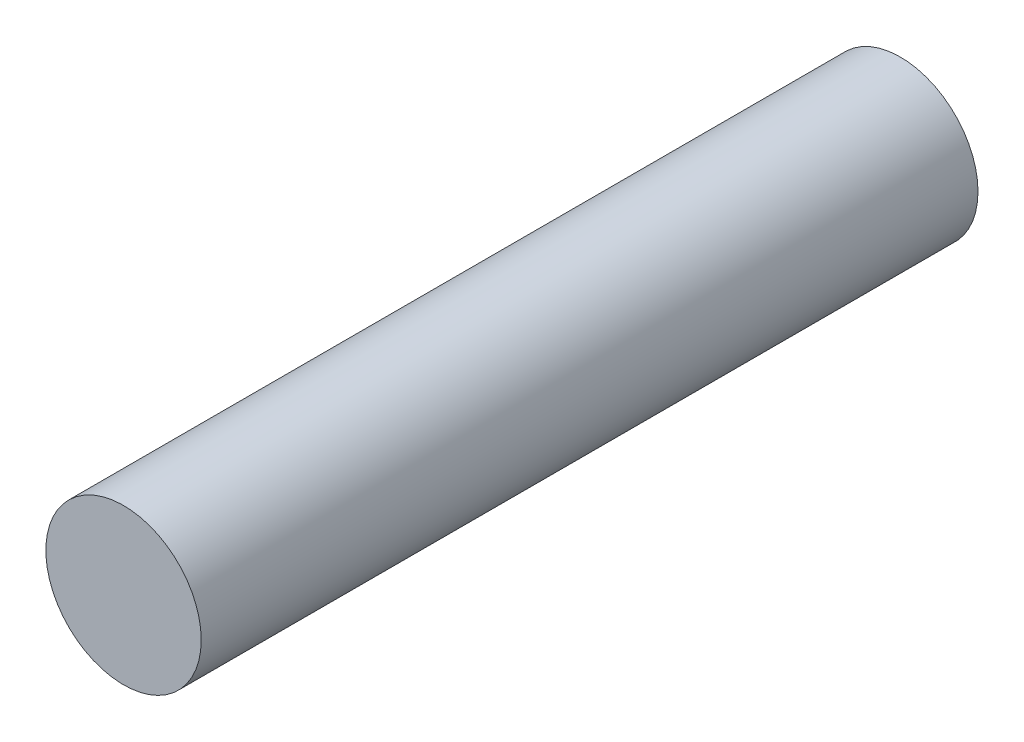
from build123d import *

# Parameters (mm, degrees)
SKETCH1_R           = 1
BOSS_EXTRUDE1_DEPTH = 10


with BuildPart() as part:
    # Sketch1 → Boss-Extrude1 (new body)
    with BuildSketch(Plane(origin=(0, 0, 0), x_dir=(0, 1, 0), z_dir=(0, 0, 1))):
        with Locations(Location((0, 0, 0), (0, 0, 270))):
            Circle(SKETCH1_R)
    extrude(amount=BOSS_EXTRUDE1_DEPTH)


solid = part.part
